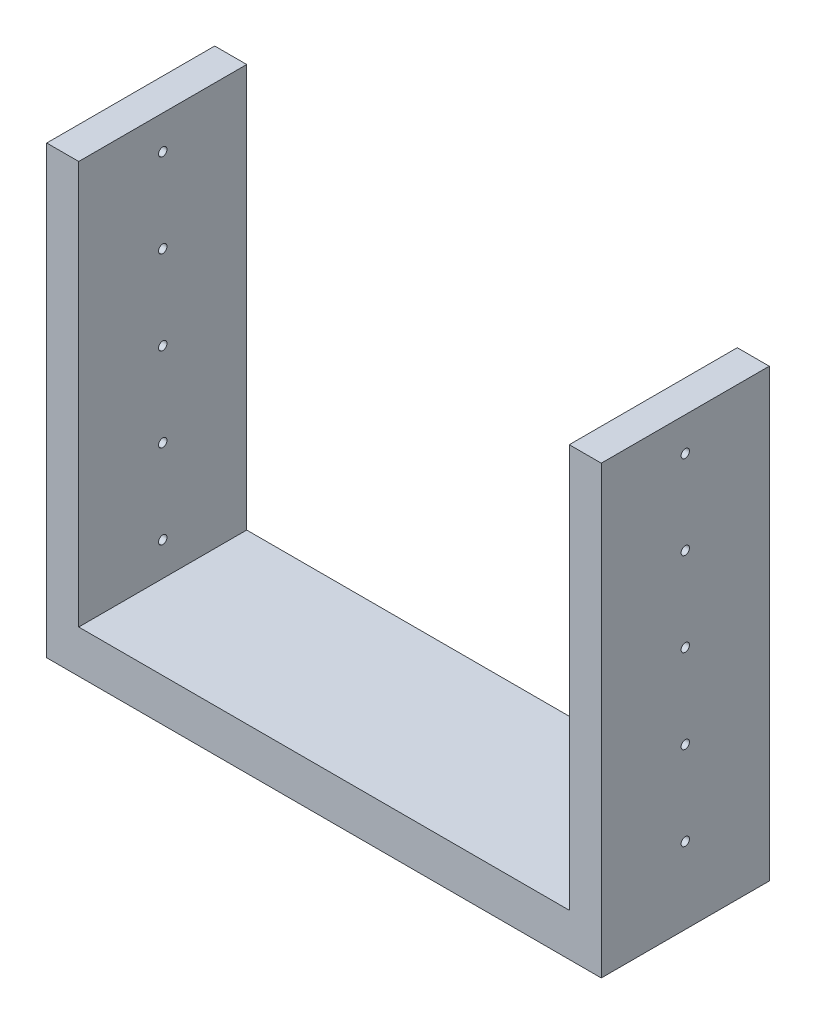
from build123d import *

# Parameters (mm, degrees)
SKETCH1_W                       = 156
SKETCH1_H                       = 50
BOSS_EXTRUDE1_DEPTH             = 12.7
SKETCH2_W                       = 9.525
SKETCH2_H                       = 50
BOSS_EXTRUDE2_DEPTH             = 120
BOSS_EXTRUDE2_DIRECTION_2_REACH = 84.887
SKETCH3_R                       = 1.25
CUT_EXTRUDE1_DEPTH              = 214.250539272


with BuildPart() as part:
    # Sketch1 → Boss-Extrude1 (new body)
    with BuildSketch(Plane(origin=(0, 0, 0), x_dir=(1, 0, 0), z_dir=(0, 1, 0))):
        Rectangle(SKETCH1_W, SKETCH1_H)
    extrude(amount=BOSS_EXTRUDE1_DEPTH)

    # Sketch2 → Boss-Extrude2 (add)
    with BuildSketch(Plane(origin=(0, 12.7, 0), x_dir=(1, 0, 0), z_dir=(0, 1, 0))):
        with Locations((-77.7625, 0)):
            Rectangle(SKETCH2_W, SKETCH2_H)
        with Locations((77.7625, 0)):
            Rectangle(SKETCH2_W, SKETCH2_H)
    extrude(amount=BOSS_EXTRUDE2_DEPTH)

    # Boss-Extrude2 direction 2: up to this face of the body (flat: up to its plane)
    boss_extrude2_direction_2_end = Plane(part.part.faces().sort_by_distance((0, 0, 0))[0])
    # Sketch2 → Boss-Extrude2 direction 2 (add, up to the picked face)
    with BuildSketch(Plane(origin=(0, 12.7, 0), x_dir=(1, 0, 0), z_dir=(0, 1, 0)), mode=Mode.PRIVATE) as boss_extrude2_direction_2_sk1:
        with Locations((-77.7625, 0)):
            Rectangle(SKETCH2_W, SKETCH2_H)
    boss_extrude2_direction_2_tool1 = split(extrude(boss_extrude2_direction_2_sk1.sketch, amount=-BOSS_EXTRUDE2_DIRECTION_2_REACH, mode=Mode.PRIVATE), bisect_by=boss_extrude2_direction_2_end, keep=Keep.BOTH, mode=Mode.PRIVATE)
    # Sketch2 → Boss-Extrude2 direction 2 (add, up to the picked face)
    with BuildSketch(Plane(origin=(0, 12.7, 0), x_dir=(1, 0, 0), z_dir=(0, 1, 0)), mode=Mode.PRIVATE) as boss_extrude2_direction_2_sk2:
        with Locations((77.7625, 0)):
            Rectangle(SKETCH2_W, SKETCH2_H)
    boss_extrude2_direction_2_tool2 = split(extrude(boss_extrude2_direction_2_sk2.sketch, amount=-BOSS_EXTRUDE2_DIRECTION_2_REACH, mode=Mode.PRIVATE), bisect_by=boss_extrude2_direction_2_end, keep=Keep.BOTH, mode=Mode.PRIVATE)
    add(boss_extrude2_direction_2_tool1.solids().sort_by(Axis((-77.7625, 12.7, 0), (0, -1, 0)))[0])
    add(boss_extrude2_direction_2_tool2.solids().sort_by(Axis((77.7625, 12.7, 0), (0, -1, 0)))[0])

    # Sketch3 → Cut-Extrude1 (cut, through all)
    with BuildSketch(Plane(origin=(82.525, 0, 0), x_dir=(0, 0, -1), z_dir=(1, 0, 0))):
        with Locations((0, 122.7)):
            Circle(SKETCH3_R)
        with Locations((0, 97.7)):
            Circle(SKETCH3_R)
        with Locations((0, 72.7)):
            Circle(SKETCH3_R)
        with Locations((0, 47.7)):
            Circle(SKETCH3_R)
        with Locations((0, 22.7)):
            Circle(SKETCH3_R)
    extrude(amount=-CUT_EXTRUDE1_DEPTH, mode=Mode.SUBTRACT)


solid = part.part
